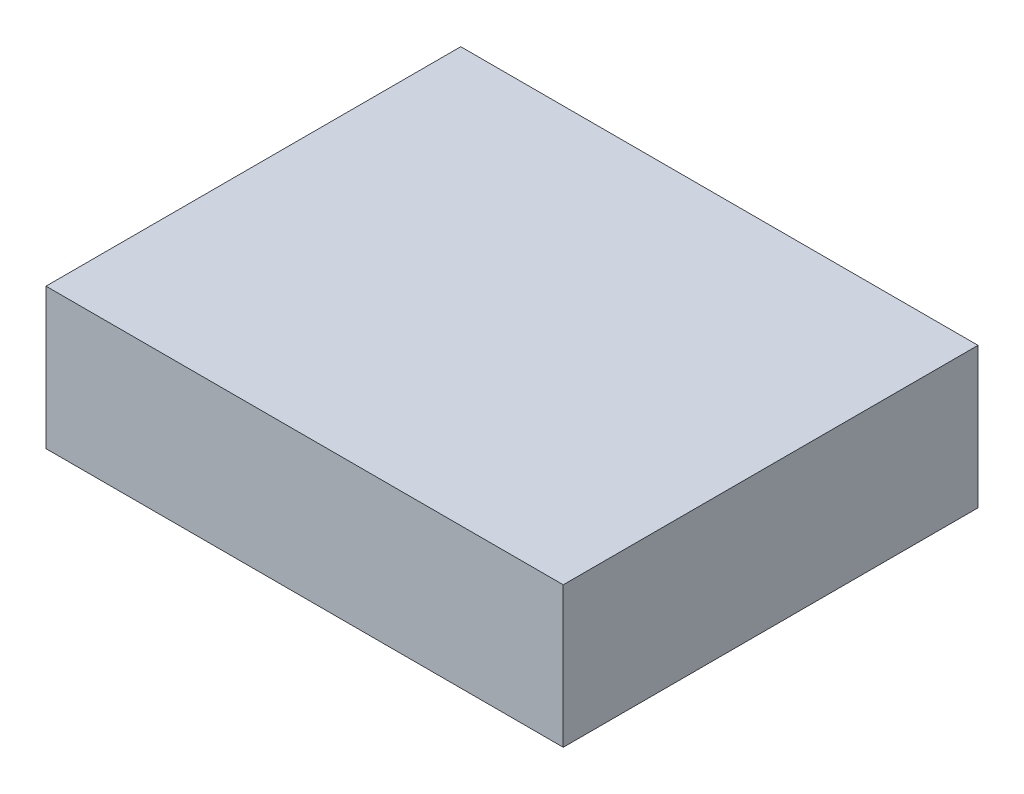
from build123d import *

# Parameters (mm, degrees)
SKETCH_1_W      = 75.7
SKETCH_1_H      = 60.7
EXTRUDE_1_DEPTH = 20.6


with BuildPart() as part:
    # 草圖1 → 填料-伸長1 (new body)
    with BuildSketch(Plane(origin=(0, 0, 0), x_dir=(1, 0, 0), z_dir=(0, 1, 0))):
        Rectangle(SKETCH_1_W, SKETCH_1_H)
    extrude(amount=EXTRUDE_1_DEPTH)


solid = part.part
